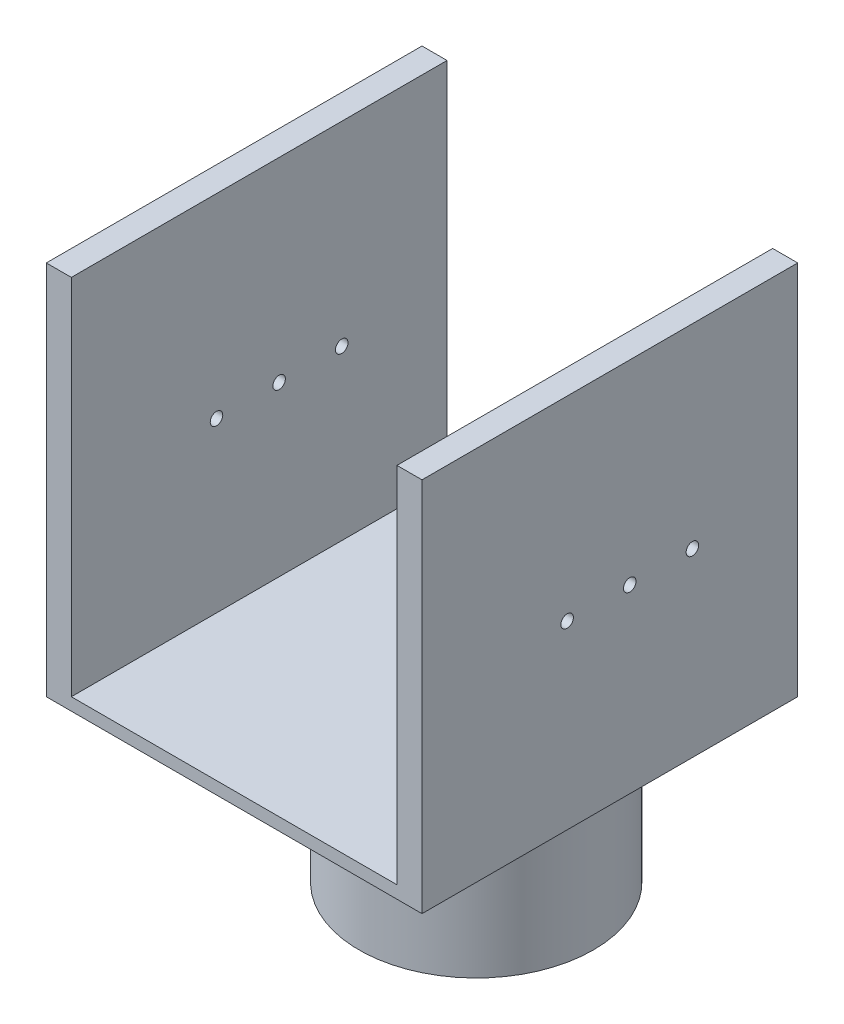
from build123d import *

# Parameters (mm, degrees)
BOSS_EXTRUDE2_DEPTH = 30
SKETCH2_R           = 9.357027653
BOSS_EXTRUDE3_DEPTH = 15
SKETCH3_R           = 8.504853576
CUT_EXTRUDE1_DEPTH  = 5.87
SKETCH4_R           = 0.5
CUT_EXTRUDE2_DEPTH  = 37.592


with BuildPart() as part:
    # Sketch1 → Boss-Extrude2 (new body)
    with BuildSketch(Plane.XY):
        Polygon((0, 30), (0, 0), (30, 0), (30, 30), (28, 30), (28, 1), (1.999996, 1), (1.999996, 30), align=None)
    extrude(amount=BOSS_EXTRUDE2_DEPTH)

    # Sketch2 → Boss-Extrude3 (add)
    with BuildSketch(Plane.XZ):
        with Locations((15, 10.669629744)):
            Circle(SKETCH2_R)
    extrude(amount=BOSS_EXTRUDE3_DEPTH)

    # Sketch3 → Cut-Extrude1 (cut)
    with BuildSketch(Plane.XZ.offset(15)):
        with Locations((15, 10.669629744)):
            Circle(SKETCH3_R)
    extrude(amount=-CUT_EXTRUDE1_DEPTH, mode=Mode.SUBTRACT)

    # Sketch4 → Cut-Extrude2 (cut)
    with BuildSketch(Plane.ZY):
        with Locations(Location((8.409330375, 14.442206742, 0), (0, 0, 270))):
            Circle(SKETCH4_R)
        with Locations(Location((13.409330375, 14.442206742, 0), (0, 0, 270))):
            Circle(SKETCH4_R)
        with Locations(Location((18.409330375, 14.442206742, 0), (0, 0, 270))):
            Circle(SKETCH4_R)
    extrude(amount=-CUT_EXTRUDE2_DEPTH, mode=Mode.SUBTRACT)


solid = part.part
